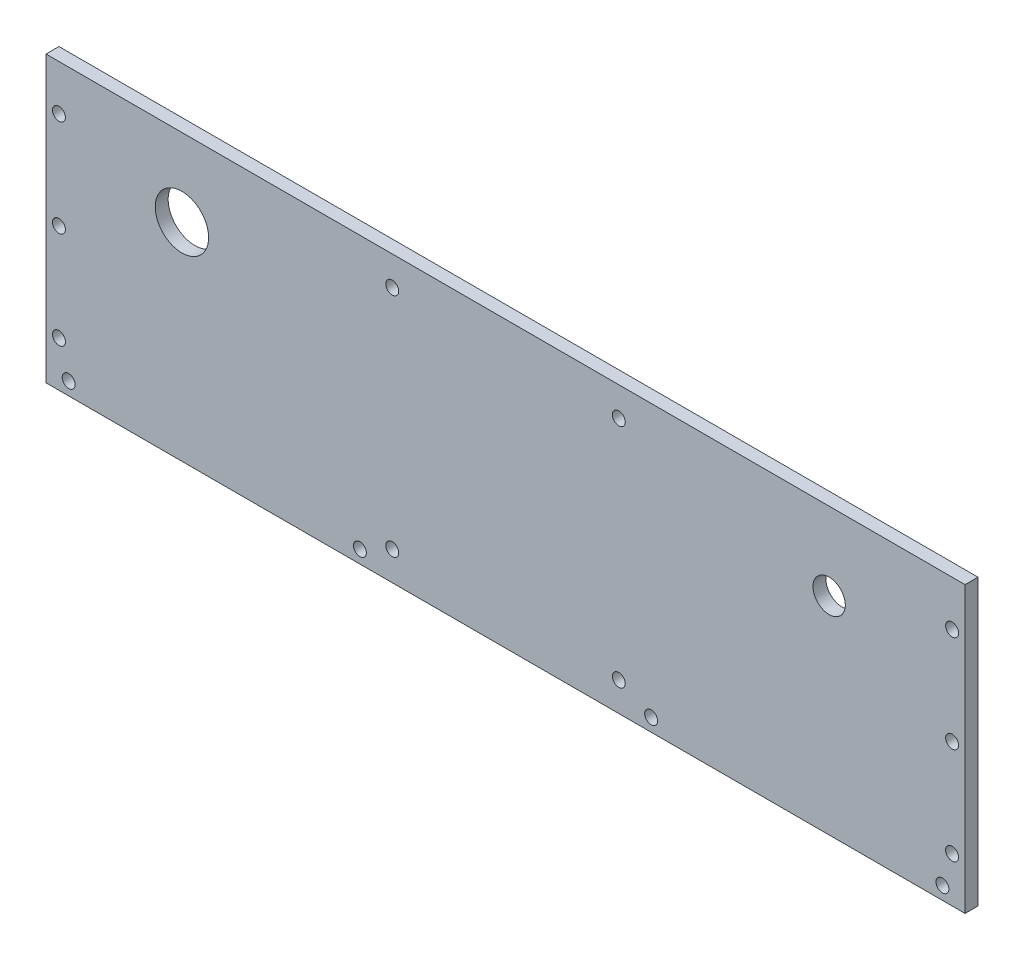
from build123d import *

# Parameters (mm, degrees)
ESQUISSE1_W             = 284
ESQUISSE1_H             = 88
BOSS_EXTRU_1_DEPTH      = 4
ESQUISSE2_R             = 2
ESQUISSE2_R_2           = 8.25
ESQUISSE2_R_3           = 5
ENL_V_MAT_EXTRU_1_DEPTH = 298.348280641


with BuildPart() as part:
    # Esquisse1 → Boss.-Extru.1 (new body)
    with BuildSketch(Plane.XY):
        with Locations((142, 44)):
            Rectangle(ESQUISSE1_W, ESQUISSE1_H)
    extrude(amount=BOSS_EXTRU_1_DEPTH)

    # Esquisse2 → Enlèv. mat.-Extru.1 (cut, through all)
    with BuildSketch(Plane.XY.offset(4)):
        with Locations((107, 79)):
            Circle(ESQUISSE2_R)
        with Locations(Location((107, 9, 0), (0, 0, 180))):
            Circle(ESQUISSE2_R)
        with Locations((177, 9)):
            Circle(ESQUISSE2_R)
        with Locations(Location((177, 79, 0), (0, 0, 180))):
            Circle(ESQUISSE2_R)
        with Locations((42, 64)):
            Circle(ESQUISSE2_R_2)
        with Locations((4, 14)):
            Circle(ESQUISSE2_R)
        with Locations(Location((4, 74, 0), (0, 0, 180))):
            Circle(ESQUISSE2_R)
        with Locations((4, 44)):
            Circle(ESQUISSE2_R)
        with Locations(Location((280, 44, 0), (0, 0, 180))):
            Circle(ESQUISSE2_R)
        with Locations((280, 74)):
            Circle(ESQUISSE2_R)
        with Locations(Location((280, 14, 0), (0, 0, 180))):
            Circle(ESQUISSE2_R)
        with Locations((7, 4)):
            Circle(ESQUISSE2_R)
        with Locations((97, 4)):
            Circle(ESQUISSE2_R)
        with Locations(Location((187, 4, 0), (0, 0, 180))):
            Circle(ESQUISSE2_R)
        with Locations(Location((277, 4, 0), (0, 0, 180))):
            Circle(ESQUISSE2_R)
        with Locations((242, 64)):
            Circle(ESQUISSE2_R_3)
    extrude(amount=-ENL_V_MAT_EXTRU_1_DEPTH, mode=Mode.SUBTRACT)


solid = part.part
